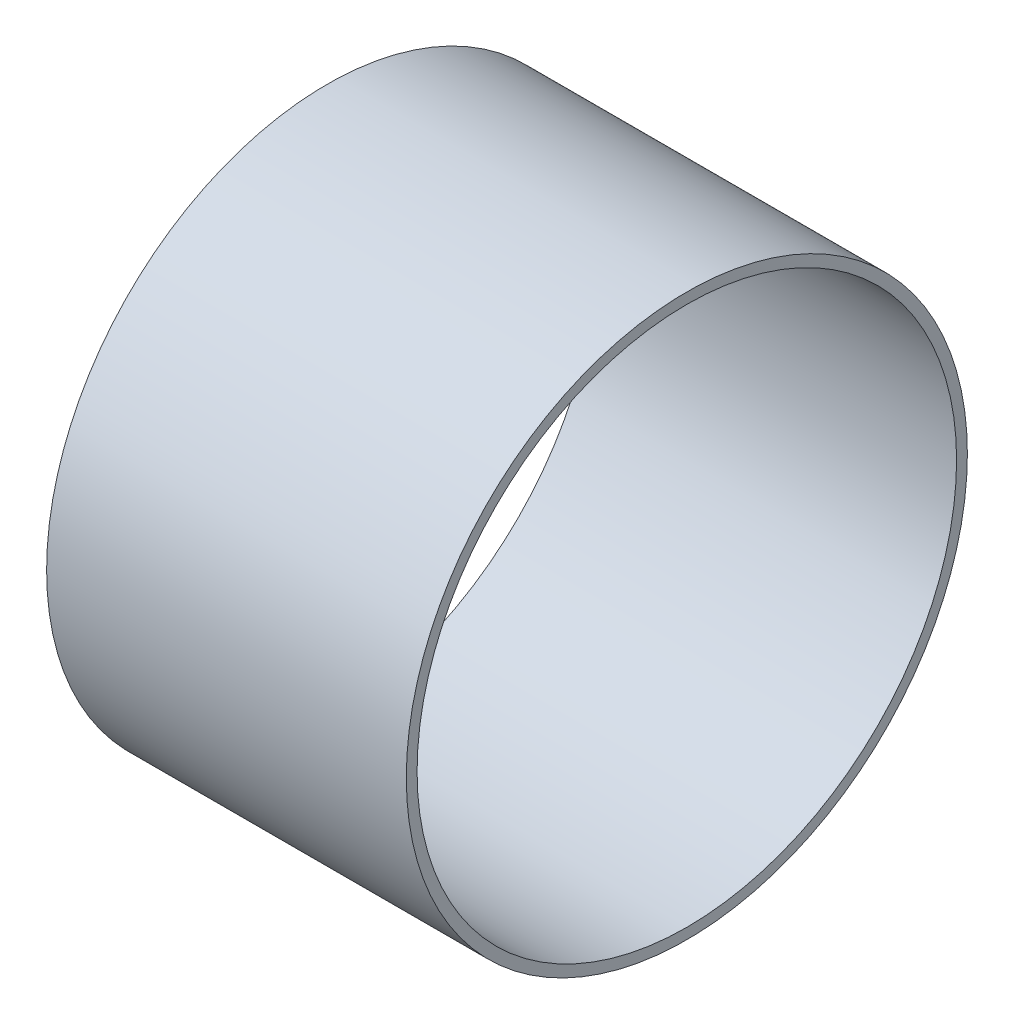
from build123d import *

# Parameters (mm, degrees)
SKETCH1_R           = 39.624
SKETCH1_R_2         = 38.1
BOSS_EXTRUDE1_DEPTH = 50.8


with BuildPart() as part:
    # Sketch1 → Boss-Extrude1 (new body)
    with BuildSketch(Plane.YZ):
        with Locations(Location((0, 0, 0), (0, 0, 270))):
            Circle(SKETCH1_R)
        with Locations(Location((0, 0, 0), (0, 0, 270))):
            Circle(SKETCH1_R_2, mode=Mode.SUBTRACT)
    extrude(amount=BOSS_EXTRUDE1_DEPTH)


solid = part.part
